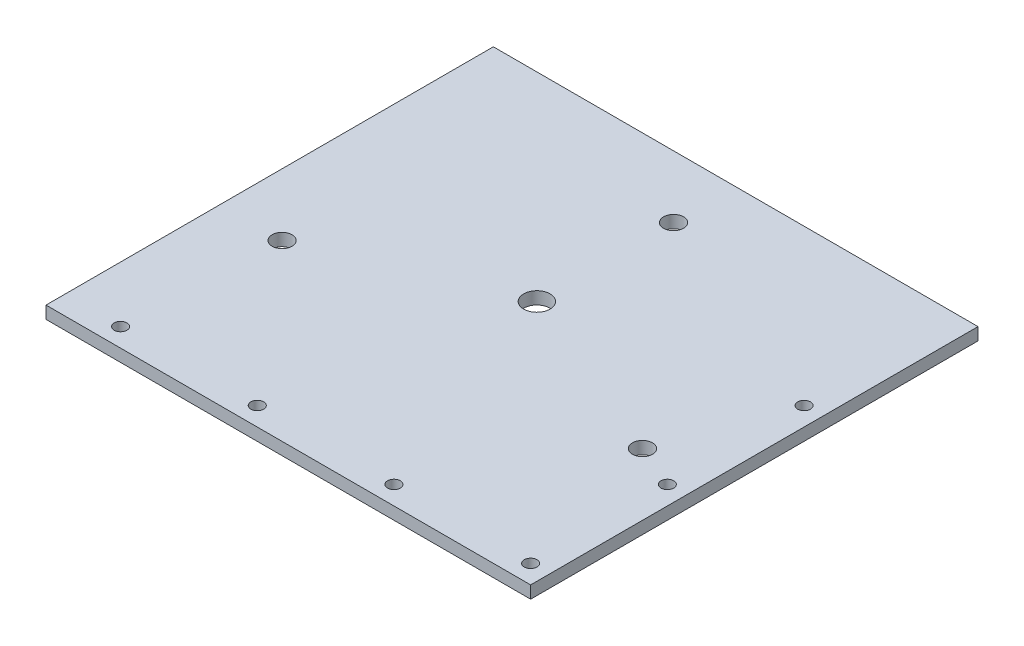
from build123d import *

# Parameters (mm, degrees)
SKETCH1_W                                = 123.825
SKETCH1_H                                = 114.3
PLATE_DEPTH                              = 3.175
FORCE_PLATE_POST_1_4_20_CLEARANCE_HOLE_D = 6.7564
F_4_CLEARANCE_HOLE1_D                    = 3.2639
F_10_CLEARANCE_HOLE1_D                   = 5.1054


with BuildPart() as part:
    # Sketch1 → Plate (new body)
    with BuildSketch(Plane(origin=(0, 0, 0), x_dir=(1, 0, 0), z_dir=(0, 1, 0))):
        Rectangle(SKETCH1_W, SKETCH1_H)
    extrude(amount=PLATE_DEPTH)

    # Force Plate Post (1/4"-20 Clearance Hole) (through all)
    with Locations(Plane(origin=(0, 3.175, 0), x_dir=(1, 0, 0), z_dir=(0, 1, 0))):
        with Locations((0, 6.35)):
            Hole(FORCE_PLATE_POST_1_4_20_CLEARANCE_HOLE_D / 2)

    # #4 Clearance Hole1 (through all)
    with Locations(Plane(origin=(0, 3.175, 0), x_dir=(1, 0, 0), z_dir=(0, 1, 0))):
        with Locations((57.15, -52.3875), (57.15, -17.4625), (57.15, 17.4625), (22.225, -52.3875), (-12.7, -52.3875), (-47.625, -52.3875)):
            Hole(F_4_CLEARANCE_HOLE1_D / 2)

    # #10 Clearance Hole1 (through all)
    with Locations(Plane(origin=(0, 3.175, 0), x_dir=(1, 0, 0), z_dir=(0, 1, 0))):
        with Locations((0, 41.275), (-46.0375, -12.7), (46.0375, -12.7)):
            Hole(F_10_CLEARANCE_HOLE1_D / 2)


solid = part.part
